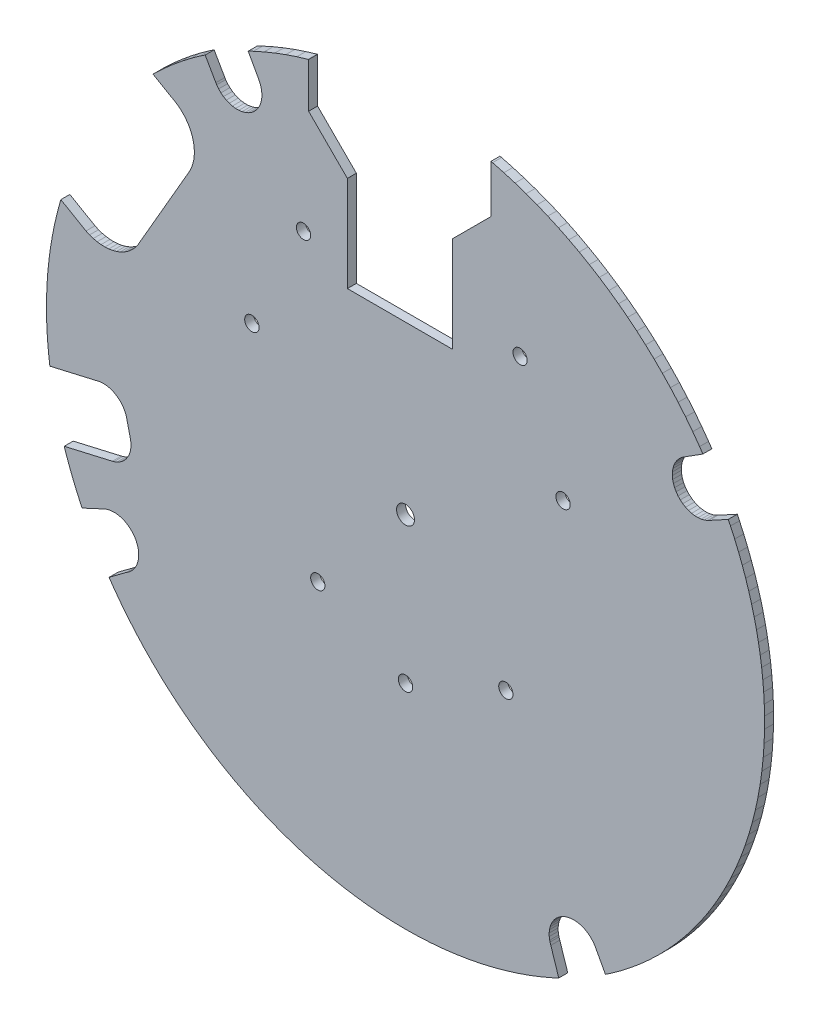
from build123d import *

# Parameters (mm, degrees)
MODEL_R             = 1.5875
MODEL_R_2           = 1.59999934
BOSS_EXTRUDE1_DEPTH = 2
SKETCH2_R           = 2
CUT_EXTRUDE1_DEPTH  = 2


with BuildPart() as part:
    # Model → Boss-Extrude1 (new body)
    with BuildSketch(Plane.XY):
        Polygon((19.04364746, 77.7128367), (19.40183064, 77.6294739), (21.913215, 76.95828144), (24.40147012, 76.2058674), (26.86397218, 75.3730268), (29.29812276, 74.46063594), (31.70135138, 73.46965748), (34.07112058, 72.4011379), (36.404931, 71.2562075), (38.70032138, 70.03607024), (40.95486602, 68.74201898), (43.16618494, 67.37541516), (45.33194896, 65.9377015), (47.449867, 64.43039946), (49.5177064, 62.855094), (51.53328276, 61.21345136), (53.49447264, 59.50720382), (55.3992034, 57.73815224), (57.2454659, 55.90816352), (59.03130942, 54.01916806), (60.75485182, 52.07315976), (62.41427192, 50.07219348), (64.00781966, 48.0183825), (65.53381356, 45.9138909), (66.26041866, 44.82775134), (62.32040114, 42.3219499), (62.01057448, 42.13945852), (61.43000668, 41.71571286), (60.9097334, 41.21979056), (60.45866242, 40.66018538), (60.08451788, 40.0464782), (59.79370312, 39.38917192), (59.59119908, 38.69952382), (59.48047286, 37.98933982), (59.4634193, 37.27077636), (59.5403305, 36.55613974), (59.7098882, 35.85766006), (59.96919172, 35.18729818), (60.31380114, 34.55653236), (60.73781604, 33.9761576), (61.2339771, 33.45611292), (61.79379056, 33.00530102), (62.40767046, 32.63144096), (63.06511136, 32.34092846), (63.75485344, 32.13874446), (64.46508824, 32.0283459), (65.18365678, 32.01162254), (65.89826038, 32.08886394), (66.59666132, 32.25874422), (67.26690128, 32.51835508), (67.5882443, 32.68071188), (71.92345026, 35.04417426), (72.42000502, 34.02506276), (73.35496378, 31.95952206), (74.23102756, 29.86831974), (75.0474877, 27.75313728), (75.80368888, 25.61566886), (76.49902912, 23.45763406), (77.13294454, 21.28076516), (77.70492714, 19.08680968), (78.21451972, 16.87752784), (78.6613108, 14.6546951), (79.04494478, 12.42009454), (79.36510924, 10.17552194), (79.62155272, 7.9227807), (79.8140644, 5.66367676), (79.94248934, 3.40002622), (80.00673102, 1.13364518), (80.00673102, 0), (80.00673102, -1.4004036), (79.90871242, -4.19948868), (79.71279714, -6.9934328), (79.4192214, -9.77880696), (79.02835096, -12.55219994), (78.5406608, -15.31021576), (77.95674782, -18.04947622), (77.2773283, -20.76662344), (76.50323536, -23.45832748), (75.63541642, -26.12129396), (74.6749332, -28.75225644), (73.6229668, -31.34799674), (72.48080246, -33.9053297), (71.24983972, -36.42112604), (69.93158734, -38.89229966), (68.52766076, -41.31582796), (67.03977956, -43.68873914), (65.46976746, -46.0081249), (63.8195447, -48.27114806), (62.0911382, -50.47502986), (60.28666124, -52.61707536), (58.40832616, -54.6946582), (56.45843166, -56.7052333), (54.43937042, -58.6463394), (52.35361386, -60.51559398), (50.20371976, -62.31071104), (47.99231702, -64.02949094), (45.7221209, -65.66982548), (44.5493267, -66.44737028), (42.33399458, -62.3425982), (42.1668321, -62.05420406), (41.78163348, -61.51045102), (41.33343016, -61.01733796), (40.82881598, -60.5821242), (40.2752179, -60.21121308), (39.6807817, -59.91006306), (39.0542526, -59.68310136), (38.40485588, -59.5336757), (37.74214194, -59.4639781), (37.07586692, -59.47503472), (36.41583014, -59.56668808), (35.77174964, -59.73758436), (35.15309962, -59.9852115), (34.56898598, -60.3059246), (34.02800154, -60.69500434), (33.5381092, -61.14672302), (33.10651494, -61.65443854), (32.73957384, -62.21067568), (32.4426834, -62.8072531), (32.22021242, -63.43538748), (32.07543242, -64.0858383), (32.01047954, -64.7490323), (32.02630374, -65.41521334), (32.12267642, -66.07457448), (32.2006722, -66.39865816), (32.37643512, -66.933191), (34.15142776, -72.3516206), (32.8739373, -72.95462168), (30.27797348, -74.0696766), (27.64426526, -75.09239236), (24.97609178, -76.02149388), (22.27678552, -76.85582292), (19.54970436, -77.59434062), (16.79825444, -78.23612496), (14.02586222, -78.78037838), (11.23598464, -79.22641762), (8.43209896, -79.5736915), (5.61770276, -79.82176568), (2.79630124, -79.97032774), (-0.02858516, -80.0191948), (-2.85343346, -79.96831098), (-5.6747283, -79.81773216), (-8.4889467, -79.56764884), (-11.29258346, -79.2183709), (-14.082141, -78.77033776), (-16.8541446, -78.22410568), (-19.60513732, -77.58035538), (-22.33168762, -76.8398895), (-25.03039952, -76.0036326), (-27.69790498, -75.07262354), (-30.33088422, -74.04802818), (-32.92605048, -72.93111906), (-35.4801678, -71.72329064), (-37.9900561, -70.42604914), (-40.45258356, -69.04101254), (-42.86467932, -67.5699055), (-45.2233411, -66.0145619), (-47.5256225, -64.3769223), (-49.7686584, -62.65902632), (-51.94964972, -60.86301772), (-54.06587612, -58.99113424), (-56.11470362, -57.0457076), (-58.09357698, -55.02916858), (-60.00002478, -52.9440267), (-61.8316772, -50.79288038), (-63.5862457, -48.5784144), (-65.26154334, -46.3033872), (-66.05709166, -45.127672), (-62.23823468, -42.2761918), (-61.92968564, -42.0871777), (-61.3532047, -41.65034596), (-60.83911378, -41.1415611), (-60.39632574, -40.569642), (-60.03251646, -39.94450736), (-59.75399276, -39.27699282), (-59.56558318, -38.57867062), (-59.47055416, -37.86164894), (-59.45863648, -37.5000012), (-59.47032556, -37.14185612), (-59.56352578, -36.43165434), (-59.74834634, -35.73961864), (-60.02163764, -35.07751176), (-60.3787591, -34.45659606), (-60.81363504, -33.88742524), (-61.31887406, -33.37967924), (-61.88588334, -32.94198644), (-62.50502358, -32.58179412), (-63.16576648, -32.30522622), (-63.85688016, -32.11698174), (-64.56661204, -32.02026362), (-65.28289458, -32.01671524), (-65.99354848, -32.10639756), (-66.68649096, -32.28778658), (-67.34994404, -32.5577962), (-67.6678987, -32.72512124), (-72.06046802, -34.7615637), (-72.62462742, -33.59206388), (-73.67645158, -31.21768458), (-74.65067366, -28.8104199), (-75.54626496, -26.37281238), (-76.05586516, -24.83318884), (-65.33552338, -22.35820776), (-64.99424644, -22.27941442), (-64.33808062, -22.03408598), (-63.71955252, -21.70520678), (-63.14924124, -21.298408), (-62.63690546, -20.82064924), (-62.1913158, -20.28010422), (-61.82009226, -19.68602362), (-61.52958738, -19.04856998), (-61.32477448, -18.37865006), (-61.20915368, -17.68772942), (-61.18470618, -16.98762922), (-61.25184854, -16.29032556), (-61.33063934, -15.94903846), (-62.1260632, -12.50366054), (-62.20486162, -12.1623836), (-62.45019006, -11.50621524), (-62.77906926, -10.8876846), (-63.1858655, -10.31737332), (-63.66362426, -9.80504008), (-64.20416928, -9.35944788), (-64.79824988, -8.98822434), (-65.43570352, -8.69771946), (-66.10562344, -8.49290402), (-66.79654408, -8.37728322), (-67.49664428, -8.35283572), (-68.19394794, -8.41997808), (-68.53523504, -8.49876888), (-79.25702716, -10.97409032), (-79.54521048, -8.67887774), (-79.78494838, -6.0930409), (-79.94065038, -3.50078802), (-80.01214884, -0.90484706), (-79.99937518, 1.6920464), (-79.90233702, 4.28715932), (-79.72113596, 6.87775358), (-79.45596758, 9.4611063), (-79.1071062, 12.03449206), (-78.67492266, 14.59520068), (-78.15986908, 17.14053976), (-77.56249156, 19.66782198), (-76.88341494, 22.17438796), (-76.81740034, 22.39006698), (-71.57962062, 19.36603442), (-71.2013943, 19.14766554), (-70.4057774, 18.78717858), (-69.57865688, 18.50640698), (-68.72800072, 18.30806346), (-67.86199788, 18.19405048), (-66.98898972, 18.16547294), (-66.11738618, 18.22260008), (-65.25557688, 18.3648858), (-64.41186508, 18.59095596), (-63.5943737, 18.89863886), (-62.81097928, 19.28496778), (-62.06922054, 19.74622162), (-61.37624758, 20.27795792), (-60.7387279, 20.87506112), (-60.16280576, 21.53177304), (-59.65402598, 22.24177416), (-59.43565202, 22.62000048), (-48.2596571, 41.9773989), (-48.04128822, 42.35562268), (-47.68079872, 43.15124212), (-47.40002966, 43.97836264), (-47.2016836, 44.8290188), (-47.08767062, 45.69502164), (-47.05909308, 46.5680298), (-47.11622022, 47.43963588), (-47.25850594, 48.30144518), (-47.48457864, 49.14515698), (-47.79226154, 49.96264836), (-48.17859046, 50.74604532), (-48.6398443, 51.48780152), (-49.17158314, 52.18077702), (-49.76868634, 52.81829416), (-50.4254008, 53.3942163), (-51.13540192, 53.90299608), (-51.51362062, 54.1213675), (-56.27645844, 56.87119182), (-55.74333022, 57.40595834), (-53.85113436, 59.18461366), (-51.90221522, 60.90092722), (-49.89862766, 62.55309562), (-47.84248242, 64.13937642), (-45.73594612, 65.65810084), (-44.64883882, 66.38075116), (-42.26658298, 62.2213894), (-42.07753586, 61.91509842), (-41.6413823, 61.34288976), (-41.13418494, 60.8325936), (-40.56464328, 60.39296024), (-39.94253124, 60.03153094), (-39.27851682, 59.75451092), (-38.58399446, 59.56664998), (-37.87087676, 59.47116884), (-37.15139636, 59.46970834), (-36.43789512, 59.56229134), (-35.74261584, 59.74733034), (-35.07748382, 60.02165034), (-34.4539062, 60.38054726), (-33.882584, 60.81786414), (-33.37331908, 61.32609782), (-32.93484396, 61.89652848), (-32.57467958, 62.51937458), (-32.2990083, 63.18395034), (-32.11255706, 63.87885116), (-32.01852626, 64.5921619), (-32.00673304, 64.95190464), (-32.01762456, 65.29763928), (-32.10449256, 65.98363232), (-32.27685188, 66.65328046), (-32.53196948, 67.29596904), (-32.6894825, 67.60426154), (-35.0586675, 71.91638652), (-33.89033608, 72.48593834), (-31.5179075, 73.54853972), (-29.11221254, 74.5335187), (-26.67579374, 75.43983134), (-24.21122158, 76.26652768), (-21.72109448, 77.01272888), (-21.59635254, 77.04573364), (-21.59635, 67.0536505), (-12.96035, 58.4176505), (-12.95035256, 58.4176505), (-12.95035002, 37.15114998), (10.41764998, 37.15114998), (10.41764998, 58.42765048), (19.04365, 67.0536505), align=None)
        with Locations((-19.55435002, -22.72935002)):
            Circle(MODEL_R, mode=Mode.SUBTRACT)
        with Locations((22.35564998, -22.72935002)):
            Circle(MODEL_R, mode=Mode.SUBTRACT)
        with Locations((-22.72935002, 43.31064998)):
            Circle(MODEL_R, mode=Mode.SUBTRACT)
        with Locations((25.53064998, 43.31064998)):
            Circle(MODEL_R, mode=Mode.SUBTRACT)
        with Locations((-34.24266202, 19.77001126)):
            Circle(MODEL_R_2, mode=Mode.SUBTRACT)
        with Locations((0, -32.5400162)):
            Circle(MODEL_R_2, mode=Mode.SUBTRACT)
        with Locations((35.10868772, 20.27001026)):
            Circle(MODEL_R_2, mode=Mode.SUBTRACT)
    extrude(amount=BOSS_EXTRUDE1_DEPTH)

    # Sketch2 → Cut-Extrude1 (cut)
    with BuildSketch(Plane.XY.offset(2)):
        with Locations((0, 1.125e-06)):
            Circle(SKETCH2_R)
    extrude(amount=-CUT_EXTRUDE1_DEPTH, mode=Mode.SUBTRACT)


solid = part.part
